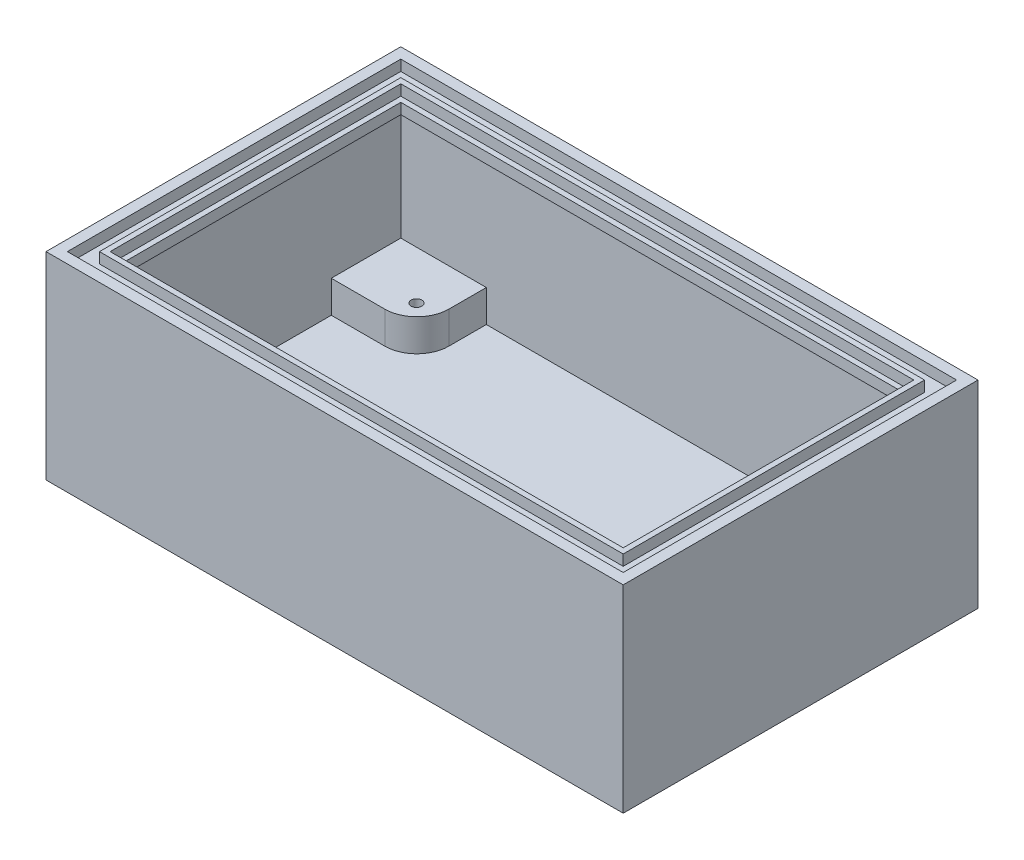
from build123d import *

# Parameters (mm, degrees)
SKETCH1_W            = 107.9734
SKETCH1_H            = 66.3682
SKETCH1_W_2          = 103.9734
SKETCH1_H_2          = 62.3682
BOSS_EXTRUDE1_DEPTH  = 35
SKETCH2_W            = 107.9734
SKETCH2_H            = 66.3682
BOSS_EXTRUDE2_DEPTH  = 2
BOSS_EXTRUDE3_DEPTH  = 6
CUT_EXTRUDE1_REACH   = 77.393
CUT_EXTRUDE1_START   = 3
SKETCH4_R            = 1
SKETCH5_W            = 103.9734
SKETCH5_H            = 62.3682
SKETCH5_W_2          = 93.9734
SKETCH5_H_2          = 52.3682
BOSS_EXTRUDE4_DEPTH  = 2
SKETCH6_W            = 97.9734
SKETCH6_H            = 56.3682
SKETCH6_W_2          = 95.9734
SKETCH6_H_2          = 54.3682
BOSS_EXTRUDE5_DEPTH  = 2
SKETCH8_W            = 1
SKETCH8_H            = 5
SKETCH8_W_2          = 5
SKETCH8_H_2          = 1
BOSS_EXTRUDE6_DEPTH  = 1.5
SKETCH9_R            = 2.5
BOSS_EXTRUDE7_DEPTH  = 1.8
SKETCH12_R           = 0.75
BOSS_EXTRUDE8_DEPTH  = 1.5
BOSS_EXTRUDE9_START  = 0.25
SKETCH13_R           = 1.25
BOSS_EXTRUDE9_DEPTH  = 1
SKETCH14_R           = 2.5
BOSS_EXTRUDE10_DEPTH = 1


with BuildPart() as part:
    # Sketch1 → Boss-Extrude1 (new body)
    with BuildSketch(Plane(origin=(0, 0, 0), x_dir=(1, 0, 0), z_dir=(0, 1, 0))):
        Rectangle(SKETCH1_W, SKETCH1_H)
        Rectangle(SKETCH1_W_2, SKETCH1_H_2, mode=Mode.SUBTRACT)
    extrude(amount=BOSS_EXTRUDE1_DEPTH)

    # Sketch2 → Boss-Extrude2 (add)
    with BuildSketch(Plane.XZ):
        Rectangle(SKETCH2_W, SKETCH2_H)
    extrude(amount=BOSS_EXTRUDE2_DEPTH)

    # Sketch3 → Boss-Extrude3 (add)
    with BuildSketch(Plane(origin=(0, 0, 0), x_dir=(1, 0, 0), z_dir=(0, 1, 0))):
        with BuildLine():
            Line((-51.9867, 18.1841), (-51.9867, 31.1841))
            Line((-51.9867, 31.1841), (-35.9867, 31.1841))
            Line((-35.9867, 31.1841), (-35.9867, 24.1841))
            ThreePointArc((-35.9867, 24.1841), (-37.744059313, 19.941459313), (-41.9867, 18.1841))
            Line((-41.9867, 18.1841), (-51.9867, 18.1841))
        make_face()
        with BuildLine():
            Line((51.9867, 18.1841), (47.9867, 18.1841))
            ThreePointArc((47.9867, 18.1841), (43.744059313, 19.941459313), (41.9867, 24.1841))
            Line((41.9867, 24.1841), (41.9867, 31.1841))
            Line((41.9867, 31.1841), (51.9867, 31.1841))
            Line((51.9867, 31.1841), (51.9867, 18.1841))
        make_face()
        with BuildLine():
            Line((41.9867, -31.1841), (41.9867, -24.1841))
            ThreePointArc((41.9867, -24.1841), (43.744059313, -19.941459313), (47.9867, -18.1841))
            Line((47.9867, -18.1841), (51.9867, -18.1841))
            Line((51.9867, -18.1841), (51.9867, -31.1841))
            Line((51.9867, -31.1841), (41.9867, -31.1841))
        make_face()
        with BuildLine():
            Line((-51.9867, -18.1841), (-41.9867, -18.1841))
            ThreePointArc((-41.9867, -18.1841), (-37.744059313, -19.941459313), (-35.9867, -24.1841))
            Line((-35.9867, -24.1841), (-35.9867, -31.1841))
            Line((-35.9867, -31.1841), (-51.9867, -31.1841))
            Line((-51.9867, -31.1841), (-51.9867, -18.1841))
        make_face()
    extrude(amount=BOSS_EXTRUDE3_DEPTH)

    # Sketch4 → Cut-Extrude1 (cut, up to next)
    with BuildSketch(Plane(origin=(0, 0, 0), x_dir=(1, 0, 0), z_dir=(0, 1, 0)).offset(CUT_EXTRUDE1_START), mode=Mode.PRIVATE) as cut_extrude1_sk1:
        with Locations(Location((-39.98825, 22.12085, 0), (0, 0, 270))):
            Circle(SKETCH4_R)
    cut_extrude1_tool1 = extrude(cut_extrude1_sk1.sketch, amount=CUT_EXTRUDE1_REACH, mode=Mode.PRIVATE) & part.part
    # Sketch4 → Cut-Extrude1 (cut, up to next)
    with BuildSketch(Plane(origin=(0, 0, 0), x_dir=(1, 0, 0), z_dir=(0, 1, 0)).offset(CUT_EXTRUDE1_START), mode=Mode.PRIVATE) as cut_extrude1_sk2:
        with Locations(Location((45.98825, 22.12085, 0), (0, 0, 90))):
            Circle(SKETCH4_R)
    cut_extrude1_tool2 = extrude(cut_extrude1_sk2.sketch, amount=CUT_EXTRUDE1_REACH, mode=Mode.PRIVATE) & part.part
    # Sketch4 → Cut-Extrude1 (cut, up to next)
    with BuildSketch(Plane(origin=(0, 0, 0), x_dir=(1, 0, 0), z_dir=(0, 1, 0)).offset(CUT_EXTRUDE1_START), mode=Mode.PRIVATE) as cut_extrude1_sk3:
        with Locations(Location((45.98825, -22.12085, 0), (0, 0, 270))):
            Circle(SKETCH4_R)
    cut_extrude1_tool3 = extrude(cut_extrude1_sk3.sketch, amount=CUT_EXTRUDE1_REACH, mode=Mode.PRIVATE) & part.part
    # Sketch4 → Cut-Extrude1 (cut, up to next)
    with BuildSketch(Plane(origin=(0, 0, 0), x_dir=(1, 0, 0), z_dir=(0, 1, 0)).offset(CUT_EXTRUDE1_START), mode=Mode.PRIVATE) as cut_extrude1_sk4:
        with Locations(Location((-39.98825, -22.12085, 0), (0, 0, 90))):
            Circle(SKETCH4_R)
    cut_extrude1_tool4 = extrude(cut_extrude1_sk4.sketch, amount=CUT_EXTRUDE1_REACH, mode=Mode.PRIVATE) & part.part
    add(cut_extrude1_tool1.solids().sort_by_distance((-39.98825, 3, -22.12085))[0], mode=Mode.SUBTRACT)
    add(cut_extrude1_tool2.solids().sort_by_distance((45.98825, 3, -22.12085))[0], mode=Mode.SUBTRACT)
    add(cut_extrude1_tool3.solids().sort_by_distance((45.98825, 3, 22.12085))[0], mode=Mode.SUBTRACT)
    add(cut_extrude1_tool4.solids().sort_by_distance((-39.98825, 3, 22.12085))[0], mode=Mode.SUBTRACT)

    # Sketch5 → Boss-Extrude4 (add)
    with BuildSketch(Plane(origin=(0, 31, 0), x_dir=(1, 0, 0), z_dir=(0, 1, 0))):
        Rectangle(SKETCH5_W, SKETCH5_H)
        Rectangle(SKETCH5_W_2, SKETCH5_H_2, mode=Mode.SUBTRACT)
    extrude(amount=BOSS_EXTRUDE4_DEPTH)

    # Sketch6 → Boss-Extrude5 (add)
    with BuildSketch(Plane(origin=(0, 33, 0), x_dir=(1, 0, 0), z_dir=(0, 1, 0))):
        Rectangle(SKETCH6_W, SKETCH6_H)
        Rectangle(SKETCH6_W_2, SKETCH6_H_2, mode=Mode.SUBTRACT)
    extrude(amount=BOSS_EXTRUDE5_DEPTH)

    # Sketch8 → Boss-Extrude6 (add)
    with BuildSketch(Plane(origin=(0, 0, 0), x_dir=(1, 0, 0), z_dir=(0, 1, 0))):
        with Locations((-46, -10)):
            Rectangle(SKETCH8_W, SKETCH8_H)
        with Locations((46, -10)):
            Rectangle(SKETCH8_W, SKETCH8_H)
        with Locations((-30, -17.5)):
            Rectangle(SKETCH8_W_2, SKETCH8_H_2)
        with Locations((30, -17.5)):
            Rectangle(SKETCH8_W_2, SKETCH8_H_2)
    extrude(amount=BOSS_EXTRUDE6_DEPTH)

    # Sketch9 → Boss-Extrude7 (add)
    with BuildSketch(Plane(origin=(0, 0, 0), x_dir=(1, 0, 0), z_dir=(0, 1, 0))):
        with Locations(Location((0, -0.5, 0), (0, 0, 90))):
            Circle(SKETCH9_R)
    extrude(amount=BOSS_EXTRUDE7_DEPTH)

    # Sketch12 → Boss-Extrude8 (add)
    with BuildSketch(Plane(origin=(0, 1.8, 0), x_dir=(1, 0, 0), z_dir=(0, 1, 0))):
        with Locations(Location((0, -0.5, 0), (0, 0, 270))):
            Circle(SKETCH12_R)
    extrude(amount=BOSS_EXTRUDE8_DEPTH)

    # Sketch14 → Boss-Extrude10 (add)
    with BuildSketch(Plane(origin=(0, 3.3, 0), x_dir=(1, 0, 0), z_dir=(0, 1, 0))):
        with Locations(Location((0, -0.5, 0), (0, 0, 90))):
            Circle(SKETCH14_R)
    extrude(amount=BOSS_EXTRUDE10_DEPTH)


with BuildPart() as body_2:
    # Sketch13 → Boss-Extrude9 (new body)
    with BuildSketch(Plane(origin=(0, 1.8, 0), x_dir=(1, 0, 0), z_dir=(0, 1, 0)).offset(BOSS_EXTRUDE9_START)):
        with BuildLine():
            Line((-2.420614591, -1.125), (-1.452368755, -4.875))
            ThreePointArc((-1.452368755, -4.875), (0, -6), (1.452368755, -4.875))
            Line((1.452368755, -4.875), (2.420614591, -1.125))
            ThreePointArc((2.420614591, -1.125), (0, 2), (-2.420614591, -1.125))
        make_face()
        with Locations(Location((0, -0.5, 0), (0, 0, 270))):
            Circle(SKETCH13_R, mode=Mode.SUBTRACT)
    extrude(amount=BOSS_EXTRUDE9_DEPTH)


solid = Compound([part.part, body_2.part])
